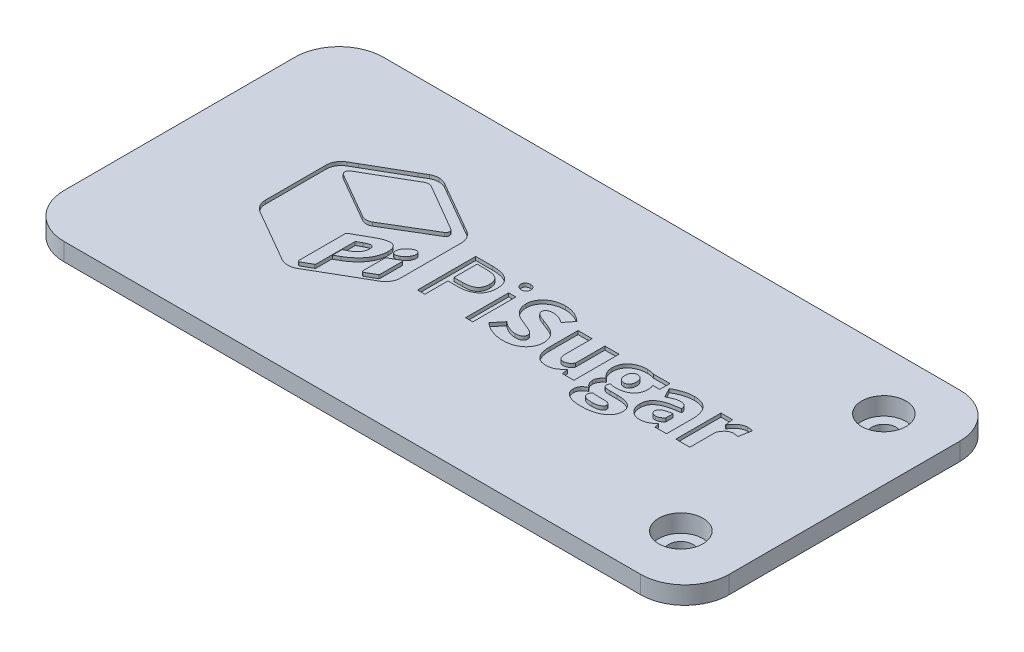
from build123d import *

# Parameters (mm, degrees)
EXTRUDE_2_DEPTH     = 2
EXTRUDE_3_DEPTH     = 1
SKETCH_4_W          = 4
SKETCH_4_H          = 10
EXTRUDE_7_DEPTH     = 2.2
SKETCH_10_R         = 3.5
EXTRUDE_10_DEPTH    = 3
SKETCH_9_R          = 2.5
CUT_EXTRUDE_3_DEPTH = 2
SKETCH_7_R          = 1.375
CUT_EXTRUDE_4_DEPTH = 4
SKETCH_12_W         = 10
SKETCH_12_H         = 1.2
EXTRUDE_11_DEPTH    = 6.7
CHAMFER_5_SIZE      = 1
CHAMFER_6_SIZE      = 1
CHAMFER_8_SIZE      = 1
SKETCH_14_W         = 0.815007944
SKETCH_14_H         = 4.86663949
CUT_EXTRUDE_8_DEPTH = 0.4


with BuildPart() as part:
    # case 2 → 凸台-拉伸2 (new body)
    with BuildSketch(Plane(origin=(0, 0, 0), x_dir=(1, 0, 0), z_dir=(0, 1, 0))):
        with BuildLine():
            Line((-34.042196447, 18), (30.957803553, 18))
            ThreePointArc((30.957803553, 18), (34.493337459, 16.535533906), (35.957803553, 13))
            Line((35.957803553, 13), (35.957803553, -13))
            ThreePointArc((35.957803553, -13), (34.493337459, -16.535533906), (30.957803553, -18))
            Line((30.957803553, -18), (-34.042196447, -18))
            ThreePointArc((-34.042196447, -18), (-37.577730353, -16.535533906), (-39.042196447, -13))
            Line((-39.042196447, -13), (-39.042196447, 13))
            ThreePointArc((-39.042196447, 13), (-37.577730353, 16.535533906), (-34.042196447, 18))
        make_face()
    extrude(amount=EXTRUDE_2_DEPTH)

    # 草图2 → 凸台-拉伸3 (add)
    with BuildSketch(Plane(origin=(0, 0, 0), x_dir=(1, 0, 0), z_dir=(0, 1, 0))):
        with BuildLine():
            Line((33.857803553, -13), (33.857803553, 13))
            ThreePointArc((33.857803553, 13), (33.008413218, 15.050609665), (30.957803553, 15.9))
            Line((30.957803553, 15.9), (-34.042196447, 15.9))
            ThreePointArc((-34.042196447, 15.9), (-36.092806113, 15.050609665), (-36.942196447, 13))
            Line((-36.942196447, 13), (-36.942196447, -13))
            ThreePointArc((-36.942196447, -13), (-36.092806113, -15.050609665), (-34.042196447, -15.9))
            Line((-34.042196447, -15.9), (30.957803553, -15.9))
            ThreePointArc((30.957803553, -15.9), (33.008413218, -15.050609665), (33.857803553, -13))
        make_face()
        with BuildLine():
            Line((-34.042196447, -14.7), (30.957803553, -14.7))
            ThreePointArc((30.957803553, -14.7), (32.159885081, -14.202081528), (32.657803553, -13))
            Line((32.657803553, -13), (32.657803553, 13))
            ThreePointArc((32.657803553, 13), (32.159885081, 14.202081528), (30.957803553, 14.7))
            Line((30.957803553, 14.7), (-34.042196447, 14.7))
            ThreePointArc((-34.042196447, 14.7), (-35.244277975, 14.202081528), (-35.742196447, 13))
            Line((-35.742196447, 13), (-35.742196447, -13))
            ThreePointArc((-35.742196447, -13), (-35.244277975, -14.202081528), (-34.042196447, -14.7))
        make_face(mode=Mode.SUBTRACT)
    extrude(amount=-EXTRUDE_3_DEPTH)

    # 草图4 → 凸台-拉伸7 (add)
    with BuildSketch(Plane(origin=(0, 0, 0), x_dir=(1, 0, 0), z_dir=(0, 1, 0))):
        with Locations((-33.742196447, 0)):
            Rectangle(SKETCH_4_W, SKETCH_4_H)
    extrude(amount=-EXTRUDE_7_DEPTH)

    # 草图10 → 凸台-拉伸10 (add)
    with BuildSketch(Plane(origin=(0, 2, 0), x_dir=(1, 0, 0), z_dir=(0, 1, 0))):
        with Locations((28.997803553, 11.4)):
            Circle(SKETCH_10_R)
        with Locations((28.997803553, -11.5)):
            Circle(SKETCH_10_R)
    extrude(amount=-EXTRUDE_10_DEPTH)

    # 草图9 → 切除-拉伸3 (cut)
    with BuildSketch(Plane(origin=(0, 2, 0), x_dir=(1, 0, 0), z_dir=(0, 1, 0))):
        with Locations(Location((28.997803553, 11.4, 0), (0, 0, 270))):
            Circle(SKETCH_9_R)
        with Locations(Location((28.997803553, -11.5, 0), (0, 0, 270))):
            Circle(SKETCH_9_R)
    extrude(amount=-CUT_EXTRUDE_3_DEPTH, mode=Mode.SUBTRACT)

    # 草图7 → 切除-拉伸4 (cut)
    with BuildSketch(Plane(origin=(0, 2, 0), x_dir=(1, 0, 0), z_dir=(0, 1, 0))):
        with Locations(Location((28.997803553, 11.4, 0), (0, 0, 270))):
            Circle(SKETCH_7_R)
        with Locations(Location((28.997803553, -11.5, 0), (0, 0, 270))):
            Circle(SKETCH_7_R)
    extrude(amount=-CUT_EXTRUDE_4_DEPTH, mode=Mode.SUBTRACT)

    # 草图12 → 凸台-拉伸11 (add)
    with BuildSketch(Plane(origin=(-31.742196447, 0, 0), x_dir=(0, 0, -1), z_dir=(1, 0, 0))):
        with Locations((0, -1.6)):
            Rectangle(SKETCH_12_W, SKETCH_12_H)
    extrude(amount=-EXTRUDE_11_DEPTH)

    # 倒角5
    chamfer_5_edges = [part.edges().sort_by_distance(p)[0] for p in [
        (-38.442196447, -1, 0),
    ]]
    chamfer(chamfer_5_edges, length=CHAMFER_5_SIZE)

    # 倒角6
    chamfer_6_edges = [part.edges().sort_by_distance(p)[0] for p in [
        (-33.742196447, 0, -5),
        (-31.742196447, 0, 0),
        (-33.742196447, 0, 5),
    ]]
    chamfer(chamfer_6_edges, length=CHAMFER_6_SIZE)

    # 倒角8
    chamfer_8_edges = [part.edges().sort_by_distance(p)[0] for p in [
        (-31.742196447, -2.2, 0),
    ]]
    chamfer(chamfer_8_edges, length=CHAMFER_8_SIZE)

    # 草图14 → 切除-拉伸8 (cut)
    # profile 1 of 9: a face of its own
    with BuildSketch(Plane(origin=(0, 2, 0), x_dir=(1, 0, 0), z_dir=(0, 1, 0))):
        with BuildLine():
            Line((-12.368120344, 5.71891476), (-13.188693381, 6.191912926))
            Line((-13.188693381, 6.191912926), (-17.445572533, 8.648032164))
            Line((-17.445572533, 8.648032164), (-18.26614557, 9.126734551))
            add(Edge.make_bspline(
                [(-18.26614557, 9.126734551), (-18.534035259, 9.274870384), (-18.830306925, 9.354659912), (-19.126648154, 9.354659912)],
                knots=[3, 3, 3, 3, 4, 4, 4, 4], degree=3))
            add(Edge.make_bspline(
                [(-19.126648154, 9.354659912), (-19.422989383, 9.354659912), (-19.719330613, 9.274870384), (-19.987150738, 9.126734551)],
                knots=[4, 4, 4, 4, 5, 5, 5, 5], degree=3))
            Line((-19.987150738, 9.126734551), (-20.807793339, 8.648032164))
            Line((-20.807793339, 8.648032164), (-25.06467249, 6.191912926))
            Line((-25.06467249, 6.191912926), (-25.885315091, 5.71891476))
            add(Edge.make_bspline(
                [(-25.885315091, 5.71891476), (-26.415251121, 5.411199871), (-26.745817675, 4.841334295), (-26.745817675, 4.231573956)],
                knots=[8, 8, 8, 8, 9, 9, 9, 9], degree=3))
            Line((-26.745817675, 4.231573956), (-26.745817675, -2.584030844))
            add(Edge.make_bspline(
                [(-26.745817675, -2.584030844), (-26.745817675, -3.199460623), (-26.415251121, -3.763656759), (-25.885315091, -4.071371648)],
                knots=[10, 10, 10, 10, 11, 11, 11, 11], degree=3))
            Line((-25.885315091, -4.071371648), (-25.06467249, -4.544369814))
            Line((-25.06467249, -4.544369814), (-20.807793339, -7.000489052))
            Line((-20.807793339, -7.000489052), (-19.987150738, -7.479156657))
            add(Edge.make_bspline(
                [(-19.987150738, -7.479156657), (-19.719330613, -7.633031493), (-19.422989383, -7.7071168), (-19.126648154, -7.7071168)],
                knots=[14, 14, 14, 14, 15, 15, 15, 15], degree=3))
            add(Edge.make_bspline(
                [(-19.126648154, -7.7071168), (-18.830306925, -7.7071168), (-18.534035259, -7.633031493), (-18.26614557, -7.479156657)],
                knots=[15, 15, 15, 15, 16, 16, 16, 16], degree=3))
            Line((-18.26614557, -7.479156657), (-17.445572533, -7.000489052))
            Line((-17.445572533, -7.000489052), (-13.188693381, -4.544369814))
            Line((-13.188693381, -4.544369814), (-12.368120344, -4.071371648))
            add(Edge.make_bspline(
                [(-12.368120344, -4.071371648), (-11.83241053, -3.763656759), (-11.50761776, -3.199460623), (-11.50761776, -2.584030844)],
                knots=[19, 19, 19, 19, 20, 20, 20, 20], degree=3))
            Line((-11.50761776, -2.584030844), (-11.50761776, 4.231573956))
            add(Edge.make_bspline(
                [(-11.50761776, 4.231573956), (-11.50761776, 4.841334295), (-11.83241053, 5.411199871), (-12.368120344, 5.71891476)],
                knots=[21, 21, 21, 21, 22, 22, 22, 22], degree=3))
        make_face()
        with BuildLine():
            Line((-24.791148144, 5.040773334), (-19.525595795, 8.083870809))
            add(Edge.make_bspline(
                [(-19.525595795, 8.083870809), (-19.280522989, 8.226337203), (-18.972773318, 8.226337203), (-18.722065856, 8.083870809)],
                knots=[3, 3, 3, 3, 4, 4, 4, 4], degree=3))
            Line((-18.722065856, 8.083870809), (-13.485034611, 5.035069113))
            add(Edge.make_bspline(
                [(-13.485034611, 5.035069113), (-13.217214486, 4.881229059), (-13.211510265, 4.493724642), (-13.47933039, 4.334145586)],
                knots=[5, 5, 5, 5, 6, 6, 6, 6], degree=3))
            Line((-13.47933039, 4.334145586), (-18.56819102, 1.291082892))
            add(Edge.make_bspline(
                [(-18.56819102, 1.291082892), (-18.910166017, 1.091609072), (-19.337565198, 1.091609072), (-19.67947063, 1.291082892)],
                knots=[7, 7, 7, 7, 8, 8, 8, 8], degree=3))
            add(Edge.make_bspline(
                [(-19.67947063, 1.291082892), (-24.831008126, 4.265764499), (-24.842416568, 4.27146872)],
                knots=[0, 0, 0, 1, 1, 1], degree=2))
            add(Edge.make_bspline(
                [(-24.842416568, 4.27146872), (-25.110236693, 4.465203538), (-25.081785153, 4.875524839), (-24.791148144, 5.040773334)],
                knots=[1, 1, 1, 1, 2, 2, 2, 2], degree=3))
        make_face(mode=Mode.SUBTRACT)
        with BuildLine():
            Line((-16.989652247, -3.866228388), (-17.582334706, -4.196725379))
            Line((-17.582334706, -4.196725379), (-17.582334706, -3.114001655))
            Line((-17.582334706, -3.114001655), (-17.058102897, -2.851850969))
            add(Edge.make_bspline(
                [(-16.100698123, -1.467081796), (-16.100698123, -2.008461048), (-16.40837823, -2.487128654), (-17.058102897, -2.851850969)],
                knots=[0, 0, 0, 0, 1, 1, 1, 1], degree=3))
            add(Edge.make_bspline(
                [(-17.092258659, -1.279016417), (-16.454011997, -0.914328883), (-16.100698123, -0.908624662), (-16.100698123, -1.467081796)],
                knots=[6, 6, 6, 6, 7, 7, 7, 7], degree=3))
            Line((-17.092258659, -1.279016417), (-17.582334706, -1.552575545))
            add(Edge.make_bspline(
                [(-17.639376914, -1.649442953), (-17.639376914, -1.609548189), (-17.616560031, -1.569653425), (-17.582334706, -1.552575545)],
                knots=[4, 4, 4, 4, 5, 5, 5, 5], degree=3))
            Line((-17.639376914, -1.649442953), (-17.639376914, -2.994317363))
            Line((-17.639376914, -2.994317363), (-17.639376914, -4.29362757))
            Line((-17.639376914, -4.29362757), (-17.639376914, -6.003224295))
            add(Edge.make_bspline(
                [(-17.639376914, -6.003224295), (-17.639376914, -6.043119059), (-17.656420013, -6.077309603), (-17.696279995, -6.100091704)],
                knots=[3, 3, 3, 3, 4, 4, 4, 4], degree=3))
            Line((-17.696279995, -6.100091704), (-18.801855384, -6.726929924))
            add(Edge.make_bspline(
                [(-18.801855384, -6.726929924), (-18.875940691, -6.766824688), (-18.967138661, -6.715556264), (-18.967138661, -6.630062515)],
                knots=[5, 5, 5, 5, 6, 6, 6, 6], degree=3))
            Line((-18.967138661, -6.630062515), (-18.967138661, -1.353101724))
            add(Edge.make_bspline(
                [(-18.967138661, -1.353101724), (-18.967138661, -1.31320696), (-18.950025999, -1.273312196), (-18.910166017, -1.256234315)],
                knots=[7, 7, 7, 7, 8, 8, 8, 8], degree=3))
            Line((-18.910166017, -1.256234315), (-17.029581793, -0.190588472))
            add(Edge.make_bspline(
                [(-17.029581793, -0.190588472), (-15.810061115, 0.498961395), (-14.80145748, 0.635723568), (-14.80145748, -0.731967725)],
                knots=[9, 9, 9, 9, 10, 10, 10, 10], degree=3))
            add(Edge.make_bspline(
                [(-14.80145748, -0.731967725), (-14.80145748, -2.048355812), (-15.821469556, -3.205164843), (-16.989652247, -3.866228388)],
                knots=[10, 10, 10, 10, 11, 11, 11, 11], degree=3))
        make_face(mode=Mode.SUBTRACT)
        with BuildLine():
            Line((-13.086156534, -3.512914514), (-14.180253917, -4.134048514))
            add(Edge.make_bspline(
                [(-14.180253917, -4.134048514), (-14.254339225, -4.173943278), (-14.345537194, -4.122640072), (-14.345537194, -4.037181105)],
                knots=[2, 2, 2, 2, 3, 3, 3, 3], degree=3))
            Line((-14.345537194, -4.037181105), (-14.345537194, -1.52405444))
            add(Edge.make_bspline(
                [(-14.345537194, -1.52405444), (-14.345537194, -1.484194458), (-14.322720311, -1.449969133), (-14.288494986, -1.427187031)],
                knots=[4, 4, 4, 4, 5, 5, 5, 5], degree=3))
            Line((-14.288494986, -1.427187031), (-13.194397602, -0.811722471))
            add(Edge.make_bspline(
                [(-13.194397602, -0.811722471), (-13.120312295, -0.771862489), (-13.029114325, -0.823130913), (-13.029114325, -0.908624662)],
                knots=[6, 6, 6, 6, 7, 7, 7, 7], degree=3))
            Line((-13.029114325, -0.908624662), (-13.029114325, -3.416012324))
            add(Edge.make_bspline(
                [(-13.029114325, -3.416012324), (-13.029114325, -3.455907088), (-13.051931209, -3.495801852), (-13.086156534, -3.512914514)],
                knots=[0, 0, 0, 0, 1, 1, 1, 1], degree=3))
        make_face(mode=Mode.SUBTRACT)
        with BuildLine():
            add(Edge.make_bspline(
                [(-13.684473649, 0.85797949), (-13.245666026, 1.108721734), (-12.932281698, 1.000445884), (-12.932281698, 0.601533025), (-12.932281698, 0.208324387), (-13.245666026, -0.253265338), (-13.684473649, -0.498303361)],
                knots=[2, 2, 2, 2, 3, 3, 3, 4, 4, 4, 4], degree=3))
            add(Edge.make_bspline(
                [(-13.684473649, -0.498303361), (-14.12891593, -0.754749827), (-14.442369821, -0.646473976), (-14.442369821, -0.253265338), (-14.442369821, 0.151351742), (-14.12891593, 0.607237246), (-13.684473649, 0.85797949)],
                knots=[0, 0, 0, 0, 1, 1, 1, 2, 2, 2, 2], degree=3))
        make_face(mode=Mode.SUBTRACT)
    # profile 2 of 9: a face of its own
    with BuildSketch(Plane(origin=(0, 2, 0), x_dir=(1, 0, 0), z_dir=(0, 1, 0))):
        with BuildLine():
            Line((-7.512854513, 3.752871569), (-9.387734516, 3.752871569))
            Line((-9.387734516, 3.752871569), (-9.387734516, -2.811956205))
            Line((-9.387734516, -2.811956205), (-8.555683473, -2.811956205))
            Line((-8.555683473, -2.811956205), (-8.555683473, -0.207666353))
            Line((-8.555683473, -0.207666353), (-7.467220746, -0.207666353))
            add(Edge.make_bspline(
                [(-7.467220746, -0.207666353), (-6.036852588, -0.207666353), (-5.050996273, 0.441953969), (-5.050996273, 1.826757924)],
                knots=[5, 5, 5, 5, 6, 6, 6, 6], degree=3))
            add(Edge.make_bspline(
                [(-5.050996273, 1.826757924), (-5.050996273, 3.262795522), (-6.036852588, 3.752871569), (-7.512854513, 3.752871569)],
                knots=[6, 6, 6, 6, 7, 7, 7, 7], degree=3))
        make_face()
        with BuildLine():
            Line((-7.575461815, 0.464770852), (-8.555683473, 0.464770852))
            Line((-8.555683473, 0.464770852), (-8.555683473, 3.080434364))
            Line((-8.555683473, 3.080434364), (-7.60968714, 3.080434364))
            add(Edge.make_bspline(
                [(-7.60968714, 3.080434364), (-6.458547548, 3.080434364), (-5.877273531, 2.778423696), (-5.877273531, 1.826757924)],
                knots=[3, 3, 3, 3, 4, 4, 4, 4], degree=3))
            add(Edge.make_bspline(
                [(-5.877273531, 1.826757924), (-5.877273531, 0.886465812), (-6.418687566, 0.464770852), (-7.575461815, 0.464770852)],
                knots=[4, 4, 4, 4, 5, 5, 5, 5], degree=3))
        make_face(mode=Mode.SUBTRACT)
    # profile 3 of 9: a face of its own
    with BuildSketch(Plane(origin=(0, 2, 0), x_dir=(1, 0, 0), z_dir=(0, 1, 0))):
        with Locations((-3.56650758, -0.37863646)):
            Rectangle(SKETCH_14_W, SKETCH_14_H)
    # profile 4 of 9: a face of its own
    with BuildSketch(Plane(origin=(0, 2, 0), x_dir=(1, 0, 0), z_dir=(0, 1, 0))):
        with BuildLine():
            Line((1.548022045, 0.977629), (0.716040565, 1.308160773))
            add(Edge.make_bspline(
                [(0.716040565, 1.308160773), (0.129062328, 1.541825137), (-0.292632633, 1.68429153), (-0.292632633, 2.054683285)],
                knots=[1, 1, 1, 1, 2, 2, 2, 2], degree=3))
            add(Edge.make_bspline(
                [(-0.292632633, 2.054683285), (-0.292632633, 2.407997159), (0.009412817, 2.60747098), (0.505193085, 2.60747098)],
                knots=[2, 2, 2, 2, 3, 3, 3, 3], degree=3))
            add(Edge.make_bspline(
                [(0.505193085, 2.60747098), (1.023720673, 2.60747098), (1.434076755, 2.430814043), (1.872814814, 2.094578049)],
                knots=[3, 3, 3, 3, 4, 4, 4, 4], degree=3))
            Line((1.872814814, 2.094578049), (2.670710096, 3.097547027))
            add(Edge.make_bspline(
                [(2.670710096, 3.097547027), (2.089436079, 3.684490482), (1.274497699, 3.980831712), (0.505193085, 3.980831712)],
                knots=[5, 5, 5, 5, 6, 6, 6, 6], degree=3))
            add(Edge.make_bspline(
                [(0.505193085, 3.980831712), (-0.913766632, 3.980831712), (-1.916735609, 3.080434364), (-1.916735609, 1.963520097)],
                knots=[6, 6, 6, 6, 7, 7, 7, 7], degree=3))
            add(Edge.make_bspline(
                [(-1.916735609, 1.963520097), (-1.916735609, 0.994741663), (-1.261445849, 0.413467646), (-0.560452758, 0.134239079)],
                knots=[7, 7, 7, 7, 8, 8, 8, 8], degree=3))
            Line((-0.560452758, 0.134239079), (0.288641384, -0.224779016))
            add(Edge.make_bspline(
                [(0.288641384, -0.224779016), (0.858506959, -0.464112818), (1.228933496, -0.589501331), (1.228933496, -0.977005749)],
                knots=[9, 9, 9, 9, 10, 10, 10, 10], degree=3))
            add(Edge.make_bspline(
                [(1.228933496, -0.977005749), (1.228933496, -1.336023843), (0.949704929, -1.558244984), (0.35702247, -1.558244984)],
                knots=[10, 10, 10, 10, 11, 11, 11, 11], degree=3))
            add(Edge.make_bspline(
                [(0.35702247, -1.558244984), (-0.167209338, -1.558244984), (-0.788412901, -1.279016417), (-1.261445849, -0.874434119)],
                knots=[11, 11, 11, 11, 12, 12, 12, 12], degree=3))
            Line((-1.261445849, -0.874434119), (-2.167443072, -1.979974726))
            add(Edge.make_bspline(
                [(-2.167443072, -1.979974726), (-1.477927986, -2.612517167), (-0.543409659, -2.937344718), (0.322797145, -2.937344718)],
                knots=[13, 13, 13, 13, 14, 14, 14, 14], degree=3))
            add(Edge.make_bspline(
                [(0.322797145, -2.937344718), (1.935561244, -2.937344718), (2.870079571, -1.962862063), (2.870079571, -0.851617235)],
                knots=[14, 14, 14, 14, 15, 15, 15, 15], degree=3))
            add(Edge.make_bspline(
                [(2.870079571, -0.851617235), (2.870079571, 0.088640094), (2.374368867, 0.64713201), (1.548022045, 0.977629)],
                knots=[15, 15, 15, 15, 16, 16, 16, 16], degree=3))
        make_face()
    # profile 5 of 9: a face of its own
    with BuildSketch(Plane(origin=(0, 2, 0), x_dir=(1, 0, 0), z_dir=(0, 1, 0))):
        with BuildLine():
            Line((6.654064901, 2.282643428), (6.654064901, -1.056795277))
            add(Edge.make_bspline(
                [(6.654064901, -1.056795277), (6.386244776, -1.432891252), (6.163919291, -1.575357646), (5.80497076, -1.575357646)],
                knots=[1, 1, 1, 1, 2, 2, 2, 2], degree=3))
            add(Edge.make_bspline(
                [(5.80497076, -1.575357646), (5.400318898, -1.575357646), (5.212288301, -1.375918608), (5.212288301, -0.669256078)],
                knots=[2, 2, 2, 2, 3, 3, 3, 3], degree=3))
            Line((5.212288301, -0.669256078), (5.212288301, 2.282643428))
            Line((5.212288301, 2.282643428), (3.622341086, 2.282643428))
            Line((3.622341086, 2.282643428), (3.622341086, -0.868729898))
            add(Edge.make_bspline(
                [(3.622341086, -0.868729898), (3.622341086, -2.139519), (4.095374034, -2.937344718), (5.20658408, -2.937344718)],
                knots=[6, 6, 6, 6, 7, 7, 7, 7], degree=3))
            add(Edge.make_bspline(
                [(5.20658408, -2.937344718), (5.901803387, -2.937344718), (6.380540556, -2.612517167), (6.802235516, -2.111032678)],
                knots=[7, 7, 7, 7, 8, 8, 8, 8], degree=3))
            Line((6.802235516, -2.111032678), (6.836391277, -2.111032678))
            Line((6.836391277, -2.111032678), (6.950406131, -2.811956205))
            Line((6.950406131, -2.811956205), (8.249646774, -2.811956205))
            Line((8.249646774, -2.811956205), (8.249646774, 2.282643428))
            Line((8.249646774, 2.282643428), (6.654064901, 2.282643428))
        make_face()
    # profile 6 of 9: a face of its own
    with BuildSketch(Plane(origin=(0, 2, 0), x_dir=(1, 0, 0), z_dir=(0, 1, 0))):
        with BuildLine():
            Line((12.101943627, -1.808987228), (11.298413688, -1.808987228))
            add(Edge.make_bspline(
                [(11.298413688, -1.808987228), (10.751364996, -1.808987228), (10.546221737, -1.700711377), (10.546221737, -1.467081796)],
                knots=[1, 1, 1, 1, 2, 2, 2, 2], degree=3))
            add(Edge.make_bspline(
                [(10.546221737, -1.467081796), (10.546221737, -1.296129079), (10.586081719, -1.216339551), (10.70573123, -1.108063701)],
                knots=[2, 2, 2, 2, 3, 3, 3, 3], degree=3))
            add(Edge.make_bspline(
                [(10.70573123, -1.108063701), (10.928056715, -1.170740566), (11.133130411, -1.199261671), (11.304117909, -1.199261671)],
                knots=[3, 3, 3, 3, 4, 4, 4, 4], degree=3))
            add(Edge.make_bspline(
                [(11.304117909, -1.199261671), (12.432440618, -1.199261671), (13.338576968, -0.680664519), (13.338576968, 0.510335055)],
                knots=[4, 4, 4, 4, 5, 5, 5, 5], degree=3))
            add(Edge.make_bspline(
                [(13.338576968, 0.510335055), (13.338576968, 0.75540786), (13.275830539, 0.989037442), (13.196110574, 1.131503836)],
                knots=[5, 5, 5, 5, 6, 6, 6, 6], degree=3))
            Line((13.196110574, 1.131503836), (13.982458287, 1.131503836))
            Line((13.982458287, 1.131503836), (13.982458287, 2.282643428))
            Line((13.982458287, 2.282643428), (12.113352069, 2.282643428))
            add(Edge.make_bspline(
                [(12.113352069, 2.282643428), (11.879687705, 2.368102395), (11.600459138, 2.407997159), (11.304117909, 2.407997159)],
                knots=[9, 9, 9, 9, 10, 10, 10, 10], degree=3))
            add(Edge.make_bspline(
                [(11.304117909, 2.407997159), (10.204316305, 2.407997159), (9.172826223, 1.803941041), (9.172826223, 0.55593404)],
                knots=[10, 10, 10, 10, 11, 11, 11, 11], degree=3))
            add(Edge.make_bspline(
                [(9.172826223, 0.55593404), (9.172826223, -0.036713637), (9.503392777, -0.509711803), (9.862341309, -0.760454047)],
                knots=[11, 11, 11, 11, 12, 12, 12, 12], degree=3))
            Line((9.862341309, -0.760454047), (9.862341309, -0.794644591))
            add(Edge.make_bspline(
                [(9.862341309, -0.794644591), (9.531844318, -1.028274173), (9.298179954, -1.387292267), (9.298179954, -1.746310362)],
                knots=[13, 13, 13, 13, 14, 14, 14, 14], degree=3))
            add(Edge.make_bspline(
                [(9.298179954, -1.746310362), (9.298179954, -2.173709544), (9.497688556, -2.441564451), (9.765508681, -2.623925608)],
                knots=[14, 14, 14, 14, 15, 15, 15, 15], degree=3))
            Line((9.765508681, -2.623925608), (9.765508681, -2.669489812))
            add(Edge.make_bspline(
                [(9.765508681, -2.669489812), (9.292475733, -2.908858396), (9.041768271, -3.250763828), (9.041768271, -3.672458789)],
                knots=[16, 16, 16, 16, 17, 17, 17, 17], degree=3))
            add(Edge.make_bspline(
                [(9.041768271, -3.672458789), (9.041768271, -4.584229796), (10.004807702, -4.954656333), (11.178764178, -4.954656333)],
                knots=[17, 17, 17, 17, 18, 18, 18, 18], degree=3))
            add(Edge.make_bspline(
                [(11.178764178, -4.954656333), (12.951037769, -4.954656333), (14.062317379, -4.19105594), (14.062317379, -3.114001655)],
                knots=[18, 18, 18, 18, 19, 19, 19, 19], degree=3))
            add(Edge.make_bspline(
                [(14.062317379, -3.114001655), (14.062317379, -2.190822206), (13.355689631, -1.808987228), (12.101943627, -1.808987228)],
                knots=[19, 19, 19, 19, 20, 20, 20, 20], degree=3))
        make_face()
        with BuildLine():
            Line((11.315526351, -3.028507906), (11.79996774, -3.028507906))
            add(Edge.make_bspline(
                [(11.79996774, -3.028507906), (12.272861561, -3.028507906), (12.54075125, -3.091184772), (12.54075125, -3.393230222)],
                knots=[4, 4, 4, 4, 5, 5, 5, 5], degree=3))
            add(Edge.make_bspline(
                [(12.54075125, -3.393230222), (12.54075125, -3.718057774), (12.084900528, -3.957391577), (11.42947164, -3.957391577)],
                knots=[5, 5, 5, 5, 6, 6, 6, 6], degree=3))
            add(Edge.make_bspline(
                [(11.42947164, -3.957391577), (10.77418188, -3.957391577), (10.346782698, -3.780734639), (10.346782698, -3.421716545)],
                knots=[0, 0, 0, 0, 1, 1, 1, 1], degree=3))
            add(Edge.make_bspline(
                [(10.346782698, -3.421716545), (10.346782698, -3.250763828), (10.426502663, -3.108297435), (10.586081719, -2.965831041)],
                knots=[1, 1, 1, 1, 2, 2, 2, 2], degree=3))
            add(Edge.make_bspline(
                [(10.586081719, -2.965831041), (10.751364996, -3.011430026), (10.945169378, -3.028507906), (11.315526351, -3.028507906)],
                knots=[2, 2, 2, 2, 3, 3, 3, 3], degree=3))
        make_face(mode=Mode.SUBTRACT)
        with BuildLine():
            add(Edge.make_bspline(
                [(11.304117909, -0.241856896), (10.939465157, -0.241856896), (10.66023659, 0.025963229), (10.66023659, 0.55593404), (10.66023659, 1.074531191), (10.939465157, 1.342351316), (11.304117909, 1.342351316)],
                knots=[2, 2, 2, 2, 3, 3, 3, 4, 4, 4, 4], degree=3))
            add(Edge.make_bspline(
                [(11.304117909, 1.342351316), (11.680248666, 1.342351316), (11.948068791, 1.074531191), (11.948068791, 0.55593404), (11.948068791, 0.025963229), (11.680248666, -0.241856896), (11.304117909, -0.241856896)],
                knots=[0, 0, 0, 0, 1, 1, 1, 2, 2, 2, 2], degree=3))
        make_face(mode=Mode.SUBTRACT)
    # profile 7 of 9: a face of its own
    with BuildSketch(Plane(origin=(0, 2, 0), x_dir=(1, 0, 0), z_dir=(0, 1, 0))):
        with BuildLine():
            Line((14.438378572, 1.741264175), (14.996835706, 0.692696213))
            add(Edge.make_bspline(
                [(14.996835706, 0.692696213), (15.504093979, 0.977629), (15.92578894, 1.137208057), (16.330371238, 1.137208057)],
                knots=[2, 2, 2, 2, 3, 3, 3, 3], degree=3))
            add(Edge.make_bspline(
                [(16.330371238, 1.137208057), (16.848898825, 1.137208057), (17.06552009, 0.897874254), (17.099675851, 0.487552953)],
                knots=[3, 3, 3, 3, 4, 4, 4, 4], degree=3))
            add(Edge.make_bspline(
                [(17.099675851, 0.487552953), (15.110850559, 0.271001252), (14.267391074, -0.310237983), (14.267391074, -1.387292267)],
                knots=[4, 4, 4, 4, 5, 5, 5, 5], degree=3))
            add(Edge.make_bspline(
                [(14.267391074, -1.387292267), (14.267391074, -2.236386409), (14.84296087, -2.937344718), (15.783322546, -2.937344718)],
                knots=[5, 5, 5, 5, 6, 6, 6, 6], degree=3))
            add(Edge.make_bspline(
                [(15.783322546, -2.937344718), (16.3474839, -2.937344718), (16.820447285, -2.675194032), (17.242142245, -2.299098057)],
                knots=[6, 6, 6, 6, 7, 7, 7, 7], degree=3))
            Line((17.242142245, -2.299098057), (17.282002227, -2.299098057))
            Line((17.282002227, -2.299098057), (17.395947517, -2.811956205))
            Line((17.395947517, -2.811956205), (18.695257724, -2.811956205))
            Line((18.695257724, -2.811956205), (18.695257724, 0.082935874))
            add(Edge.make_bspline(
                [(18.695257724, 0.082935874), (18.695257724, 1.67858731), (17.948769993, 2.407997159), (16.632416688, 2.407997159)],
                knots=[11, 11, 11, 11, 12, 12, 12, 12], degree=3))
            add(Edge.make_bspline(
                [(16.632416688, 2.407997159), (15.840225627, 2.407997159), (15.110850559, 2.140177034), (14.438378572, 1.741264175)],
                knots=[0, 0, 0, 0, 1, 1, 1, 1], degree=3))
        make_face()
        with BuildLine():
            Line((17.099675851, -0.481225481), (17.099675851, -1.296129079))
            add(Edge.make_bspline(
                [(17.099675851, -1.296129079), (16.866011488, -1.546871324), (16.655164007, -1.700711377), (16.330371238, -1.700711377)],
                knots=[0, 0, 0, 0, 1, 1, 1, 1], degree=3))
            add(Edge.make_bspline(
                [(16.330371238, -1.700711377), (15.999804683, -1.700711377), (15.783322546, -1.558244984), (15.783322546, -1.261938536)],
                knots=[1, 1, 1, 1, 2, 2, 2, 2], degree=3))
            add(Edge.make_bspline(
                [(15.783322546, -1.261938536), (15.783322546, -0.902920441), (16.108115316, -0.617987654), (17.099675851, -0.481225481)],
                knots=[2, 2, 2, 2, 3, 3, 3, 3], degree=3))
        make_face(mode=Mode.SUBTRACT)
    # profile 8 of 9: a face of its own
    with BuildSketch(Plane(origin=(0, 2, 0), x_dir=(1, 0, 0), z_dir=(0, 1, 0))):
        with BuildLine():
            Line((21.185637068, 1.399358743), (21.151411743, 1.399358743))
            Line((21.151411743, 1.399358743), (21.043170674, 2.282643428))
            Line((21.043170674, 2.282643428), (19.743860468, 2.282643428))
            Line((19.743860468, 2.282643428), (19.743860468, -2.811956205))
            Line((19.743860468, -2.811956205), (21.328103462, -2.811956205))
            Line((21.328103462, -2.811956205), (21.328103462, 0.100048536))
            add(Edge.make_bspline(
                [(21.328103462, 0.100048536), (21.595923587, 0.772485741), (22.051843873, 1.011819544), (22.427905066, 1.011819544)],
                knots=[7, 7, 7, 7, 8, 8, 8, 8], degree=3))
            add(Edge.make_bspline(
                [(22.427905066, 1.011819544), (22.655865209, 1.011819544), (22.804035824, 0.977629), (22.9863622, 0.932064797)],
                knots=[8, 8, 8, 8, 9, 9, 9, 9], degree=3))
            Line((22.9863622, 0.932064797), (23.254182325, 2.305425529))
            add(Edge.make_bspline(
                [(23.254182325, 2.305425529), (23.111715931, 2.368102395), (22.940797997, 2.407997159), (22.638752547, 2.407997159)],
                knots=[10, 10, 10, 10, 11, 11, 11, 11], degree=3))
            add(Edge.make_bspline(
                [(22.638752547, 2.407997159), (22.125859616, 2.407997159), (21.561698262, 2.077465387), (21.185637068, 1.399358743)],
                knots=[0, 0, 0, 0, 1, 1, 1, 1], degree=3))
        make_face()
    # profile 9 of 9: a face of its own
    with BuildSketch(Plane(origin=(0, 2, 0), x_dir=(1, 0, 0), z_dir=(0, 1, 0))):
        with BuildLine():
            add(Edge.make_bspline(
                [(-3.563655469, 3.057652263), (-3.238862699, 3.057652263), (-2.999494115, 3.279908184), (-2.999494115, 3.581918853), (-2.999494115, 3.918154846), (-3.238862699, 4.111889664), (-3.563655469, 4.111889664)],
                knots=[2, 2, 2, 2, 3, 3, 3, 4, 4, 4, 4], degree=3))
            add(Edge.make_bspline(
                [(-3.563655469, 4.111889664), (-3.888448239, 4.111889664), (-4.127816824, 3.918154846), (-4.127816824, 3.581918853), (-4.127816824, 3.279908184), (-3.888448239, 3.057652263), (-3.563655469, 3.057652263)],
                knots=[0, 0, 0, 0, 1, 1, 1, 2, 2, 2, 2], degree=3))
        make_face()
    extrude(amount=-CUT_EXTRUDE_8_DEPTH, mode=Mode.SUBTRACT)


solid = part.part
